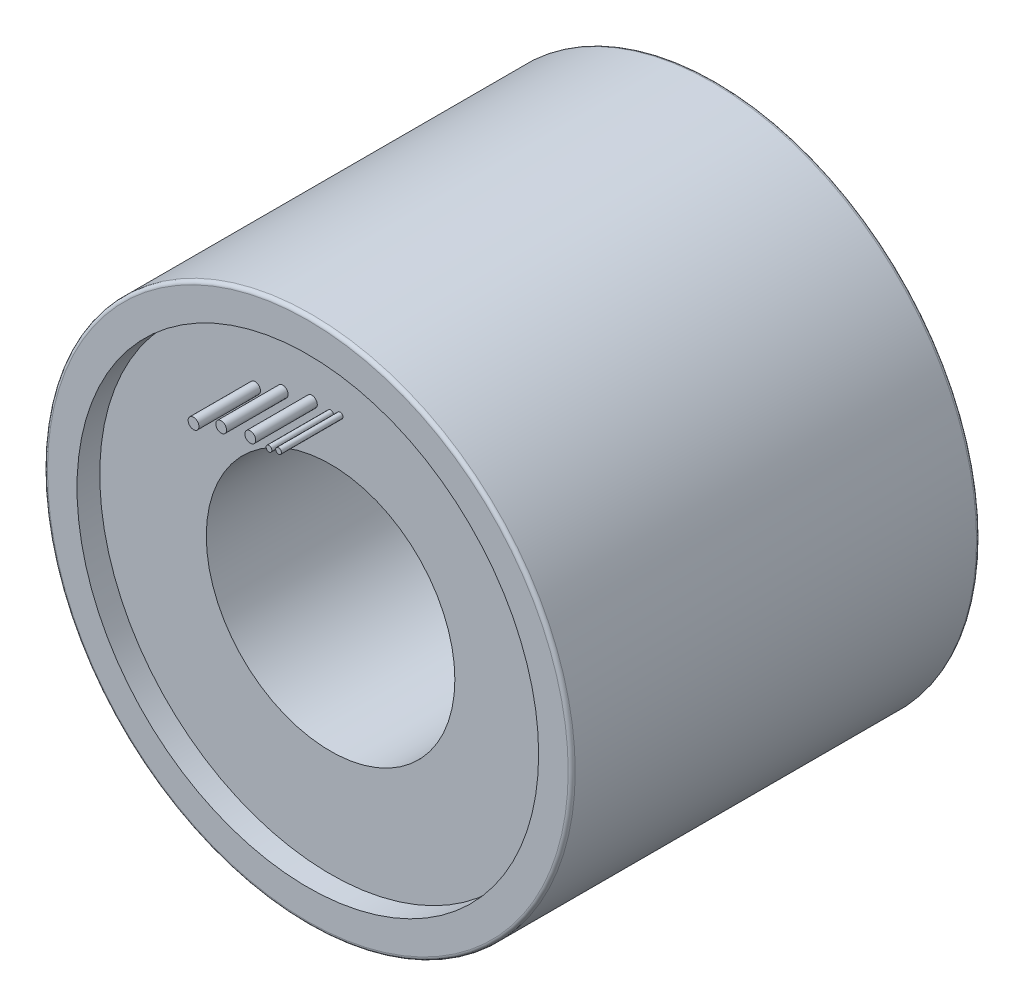
from build123d import *

# Parameters (mm, degrees)
SKETCH_1_R          = 37.4815
EXTRUDE_1_DEPTH     = 58
SKETCH_2_R          = 32.785
CUT_EXTRUDE_1_DEPTH = 0.5
CUT_EXTRUDE_START   = -3.23
SKETCH_3_R          = 32.785
CUT_EXTRUDE_2_DEPTH = 3.23
SKETCH_4_R          = 17.655
CUT_EXTRUDE_3_DEPTH = 79.204703724
SKETCH_5_R          = 0.766
SKETCH_5_R_2        = 0.4065
EXTRUDE_2_DEPTH     = 8.75
FILLET_1_R          = 0.5


with BuildPart() as part:
    # 草图1 → 凸台-拉伸1 (new body)
    with BuildSketch(Plane.XY):
        with Locations(Location((0, 0, 0), (0, 0, 180))):
            Circle(SKETCH_1_R)
    extrude(amount=EXTRUDE_1_DEPTH)

    # 草图2 → 切除-拉伸1 (cut)
    with BuildSketch(Plane(origin=(0, 0, 0), x_dir=(-1, 0, 0), z_dir=(0, 0, -1))):
        Circle(SKETCH_2_R)
    extrude(amount=-CUT_EXTRUDE_1_DEPTH, mode=Mode.SUBTRACT)

    # 草图3 → 切除-拉伸2 (cut)
    with BuildSketch(Plane.XY.offset(58).offset(CUT_EXTRUDE_START)):
        with Locations(Location((0, 0, 0), (0, 0, 180))):
            Circle(SKETCH_3_R)
    extrude(amount=CUT_EXTRUDE_2_DEPTH, mode=Mode.SUBTRACT)

    # 草图4 → 切除-拉伸3 (cut, through all)
    with BuildSketch(Plane(origin=(0, 0, 0.5), x_dir=(-1, 0, 0), z_dir=(0, 0, -1))):
        Circle(SKETCH_4_R)
    extrude(amount=-CUT_EXTRUDE_3_DEPTH, mode=Mode.SUBTRACT)

    # 草图5 → 凸台-拉伸2 (add)
    with BuildSketch(Plane.XY.offset(54.77)):
        with Locations((-10.715657222, 21.691015019)):
            Circle(SKETCH_5_R)
        with Locations((-6.786257081, 23.22223411)):
            Circle(SKETCH_5_R)
        with Locations((-2.650659953, 24.04785737)):
            Circle(SKETCH_5_R)
        with Locations((0, 23.9425)):
            Circle(SKETCH_5_R_2)
        with Locations((1.356512851, 24.339227635)):
            Circle(SKETCH_5_R_2)
    extrude(amount=EXTRUDE_2_DEPTH)

    # 圆角1
    fillet_1_edges = [part.edges().sort_by_distance(p)[0] for p in [
        (37.4815, 0, 0),
        (37.4815, 0, 58),
    ]]
    fillet(fillet_1_edges, radius=FILLET_1_R)


solid = part.part
